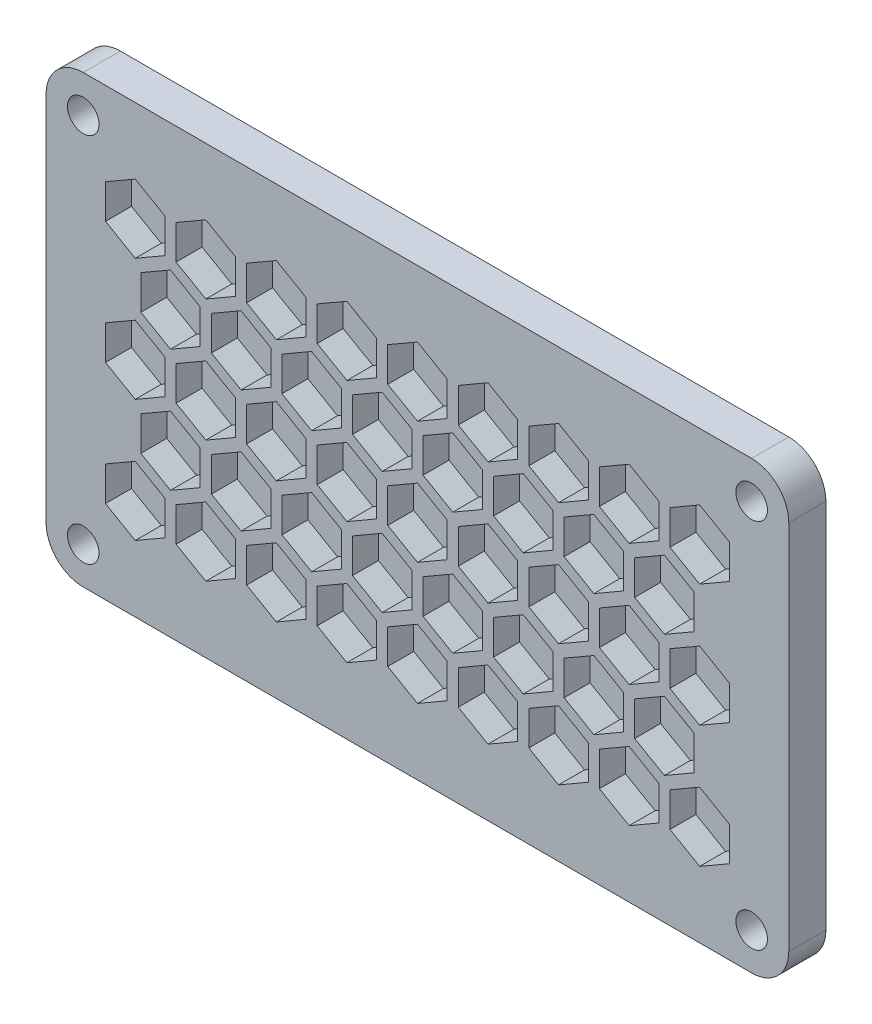
from build123d import *

# Parameters (mm, degrees)
EXTRUDE_1_DEPTH     = 10
CUT_EXTRUDE_1_DEPTH = 7
CUT_EXTRUDE_2_DEPTH = 7
SKETCH_4_R          = 4.25
CUT_EXTRUDE_3_DEPTH = 118.046999107


with BuildPart() as part:
    # 草图1 → 凸台-拉伸1 (new body)
    with BuildSketch(Plane.XY):
        with BuildLine():
            Line((-90, -60), (90, -60))
            ThreePointArc((90, -60), (97.071067812, -57.071067812), (100, -50))
            Line((100, -50), (100, 50))
            ThreePointArc((100, 50), (97.071067812, 57.071067812), (90, 60))
            Line((90, 60), (-90, 60))
            ThreePointArc((-90, 60), (-97.071067812, 57.071067812), (-100, 50))
            Line((-100, 50), (-100, -50))
            ThreePointArc((-100, -50), (-97.071067812, -57.071067812), (-90, -60))
        make_face()
    extrude(amount=EXTRUDE_1_DEPTH)

    # 草图2 → 切除-拉伸1 (cut)
    with BuildSketch(Plane.XY.offset(10)):
        Polygon((0, 9.237604307), (-8, 4.618802154), (-8, -4.618802154), (0, -9.237604307), (8, -4.618802154), (8, 4.618802154), align=None)
        Polygon((19, 9.237604307), (11, 4.618802154), (11, -4.618802154), (19, -9.237604307), (27, -4.618802154), (27, 4.618802154), align=None)
        Polygon((-19, 9.237604307), (-27, 4.618802154), (-27, -4.618802154), (-19, -9.237604307), (-11, -4.618802154), (-11, 4.618802154), align=None)
        Polygon((38, 9.237604307), (30, 4.618802154), (30, -4.618802154), (38, -9.237604307), (46, -4.618802154), (46, 4.618802154), align=None)
        Polygon((-38, 9.237604307), (-46, 4.618802154), (-46, -4.618802154), (-38, -9.237604307), (-30, -4.618802154), (-30, 4.618802154), align=None)
        Polygon((57, 9.237604307), (49, 4.618802154), (49, -4.618802154), (57, -9.237604307), (65, -4.618802154), (65, 4.618802154), align=None)
        Polygon((-57, 9.237604307), (-65, 4.618802154), (-65, -4.618802154), (-57, -9.237604307), (-49, -4.618802154), (-49, 4.618802154), align=None)
        Polygon((76, 9.237604307), (68, 4.618802154), (68, -4.618802154), (76, -9.237604307), (84, -4.618802154), (84, 4.618802154), align=None)
        Polygon((-76, 9.237604307), (-84, 4.618802154), (-84, -4.618802154), (-76, -9.237604307), (-68, -4.618802154), (-68, 4.618802154), align=None)
    extrude(amount=-CUT_EXTRUDE_1_DEPTH, mode=Mode.SUBTRACT)

    # 草图3 → 切除-拉伸2 (cut)
    with BuildSketch(Plane.XY.offset(10)):
        Polygon((9.5, 25.691604307), (1.5, 21.072802154), (1.5, 11.835197846), (9.5, 7.216395693), (17.5, 11.835197846), (17.5, 21.072802154), align=None)
        Polygon((-9.5, 25.691604307), (-17.5, 21.072802154), (-17.5, 11.835197846), (-9.5, 7.216395693), (-1.5, 11.835197846), (-1.5, 21.072802154), align=None)
        Polygon((28.5, 25.691604307), (20.5, 21.072802154), (20.5, 11.835197846), (28.5, 7.216395693), (36.5, 11.835197846), (36.5, 21.072802154), align=None)
        Polygon((-28.5, 25.691604307), (-36.5, 21.072802154), (-36.5, 11.835197846), (-28.5, 7.216395693), (-20.5, 11.835197846), (-20.5, 21.072802154), align=None)
        Polygon((47.5, 25.691604307), (39.5, 21.072802154), (39.5, 11.835197846), (47.5, 7.216395693), (55.5, 11.835197846), (55.5, 21.072802154), align=None)
        Polygon((-47.5, 25.691604307), (-55.5, 21.072802154), (-55.5, 11.835197846), (-47.5, 7.216395693), (-39.5, 11.835197846), (-39.5, 21.072802154), align=None)
        Polygon((66.5, 25.691604307), (58.5, 21.072802154), (58.5, 11.835197846), (66.5, 7.216395693), (74.5, 11.835197846), (74.5, 21.072802154), align=None)
        Polygon((-66.5, 25.691604307), (-74.5, 21.072802154), (-74.5, 11.835197846), (-66.5, 7.216395693), (-58.5, 11.835197846), (-58.5, 21.072802154), align=None)
        Polygon((9.5, -7.216395693), (1.5, -11.835197846), (1.5, -21.072802154), (9.5, -25.691604307), (17.5, -21.072802154), (17.5, -11.835197846), align=None)
        Polygon((-9.5, -7.216395693), (-17.5, -11.835197846), (-17.5, -21.072802154), (-9.5, -25.691604307), (-1.5, -21.072802154), (-1.5, -11.835197846), align=None)
        Polygon((28.5, -7.216395693), (20.5, -11.835197846), (20.5, -21.072802154), (28.5, -25.691604307), (36.5, -21.072802154), (36.5, -11.835197846), align=None)
        Polygon((-28.5, -7.216395693), (-36.5, -11.835197846), (-36.5, -21.072802154), (-28.5, -25.691604307), (-20.5, -21.072802154), (-20.5, -11.835197846), align=None)
        Polygon((47.5, -7.216395693), (39.5, -11.835197846), (39.5, -21.072802154), (47.5, -25.691604307), (55.5, -21.072802154), (55.5, -11.835197846), align=None)
        Polygon((-47.5, -7.216395693), (-55.5, -11.835197846), (-55.5, -21.072802154), (-47.5, -25.691604307), (-39.5, -21.072802154), (-39.5, -11.835197846), align=None)
        Polygon((66.5, -7.216395693), (58.5, -11.835197846), (58.5, -21.072802154), (66.5, -25.691604307), (74.5, -21.072802154), (74.5, -11.835197846), align=None)
        Polygon((-66.5, -7.216395693), (-74.5, -11.835197846), (-74.5, -21.072802154), (-66.5, -25.691604307), (-58.5, -21.072802154), (-58.5, -11.835197846), align=None)
        Polygon((0, 42.146604307), (-8, 37.527802154), (-8, 28.290197846), (0, 23.671395693), (8, 28.290197846), (8, 37.527802154), align=None)
        Polygon((19, 42.146604307), (11, 37.527802154), (11, 28.290197846), (19, 23.671395693), (27, 28.290197846), (27, 37.527802154), align=None)
        Polygon((-19, 42.146604307), (-27, 37.527802154), (-27, 28.290197846), (-19, 23.671395693), (-11, 28.290197846), (-11, 37.527802154), align=None)
        Polygon((38, 42.146604307), (30, 37.527802154), (30, 28.290197846), (38, 23.671395693), (46, 28.290197846), (46, 37.527802154), align=None)
        Polygon((-38, 42.146604307), (-46, 37.527802154), (-46, 28.290197846), (-38, 23.671395693), (-30, 28.290197846), (-30, 37.527802154), align=None)
        Polygon((57, 42.146604307), (49, 37.527802154), (49, 28.290197846), (57, 23.671395693), (65, 28.290197846), (65, 37.527802154), align=None)
        Polygon((-57, 42.146604307), (-65, 37.527802154), (-65, 28.290197846), (-57, 23.671395693), (-49, 28.290197846), (-49, 37.527802154), align=None)
        Polygon((76, 42.146604307), (68, 37.527802154), (68, 28.290197846), (76, 23.671395693), (84, 28.290197846), (84, 37.527802154), align=None)
        Polygon((-76, 42.146604307), (-84, 37.527802154), (-84, 28.290197846), (-76, 23.671395693), (-68, 28.290197846), (-68, 37.527802154), align=None)
        Polygon((0, -23.671395693), (-8, -28.290197846), (-8, -37.527802154), (0, -42.146604307), (8, -37.527802154), (8, -28.290197846), align=None)
        Polygon((19, -23.671395693), (11, -28.290197846), (11, -37.527802154), (19, -42.146604307), (27, -37.527802154), (27, -28.290197846), align=None)
        Polygon((-19, -23.671395693), (-27, -28.290197846), (-27, -37.527802154), (-19, -42.146604307), (-11, -37.527802154), (-11, -28.290197846), align=None)
        Polygon((38, -23.671395693), (30, -28.290197846), (30, -37.527802154), (38, -42.146604307), (46, -37.527802154), (46, -28.290197846), align=None)
        Polygon((-38, -23.671395693), (-46, -28.290197846), (-46, -37.527802154), (-38, -42.146604307), (-30, -37.527802154), (-30, -28.290197846), align=None)
        Polygon((57, -23.671395693), (49, -28.290197846), (49, -37.527802154), (57, -42.146604307), (65, -37.527802154), (65, -28.290197846), align=None)
        Polygon((-57, -23.671395693), (-65, -28.290197846), (-65, -37.527802154), (-57, -42.146604307), (-49, -37.527802154), (-49, -28.290197846), align=None)
        Polygon((76, -23.671395693), (68, -28.290197846), (68, -37.527802154), (76, -42.146604307), (84, -37.527802154), (84, -28.290197846), align=None)
        Polygon((-76, -23.671395693), (-84, -28.290197846), (-84, -37.527802154), (-76, -42.146604307), (-68, -37.527802154), (-68, -28.290197846), align=None)
    extrude(amount=-CUT_EXTRUDE_2_DEPTH, mode=Mode.SUBTRACT)

    # 草图4 → 切除-拉伸3 (cut, through all)
    with BuildSketch(Plane.XY.offset(10)):
        with Locations((90, 50)):
            Circle(SKETCH_4_R)
        with Locations((90, -50)):
            Circle(SKETCH_4_R)
        with Locations((-90, 50)):
            Circle(SKETCH_4_R)
        with Locations((-90, -50)):
            Circle(SKETCH_4_R)
    extrude(amount=-CUT_EXTRUDE_3_DEPTH, mode=Mode.SUBTRACT)


solid = part.part
